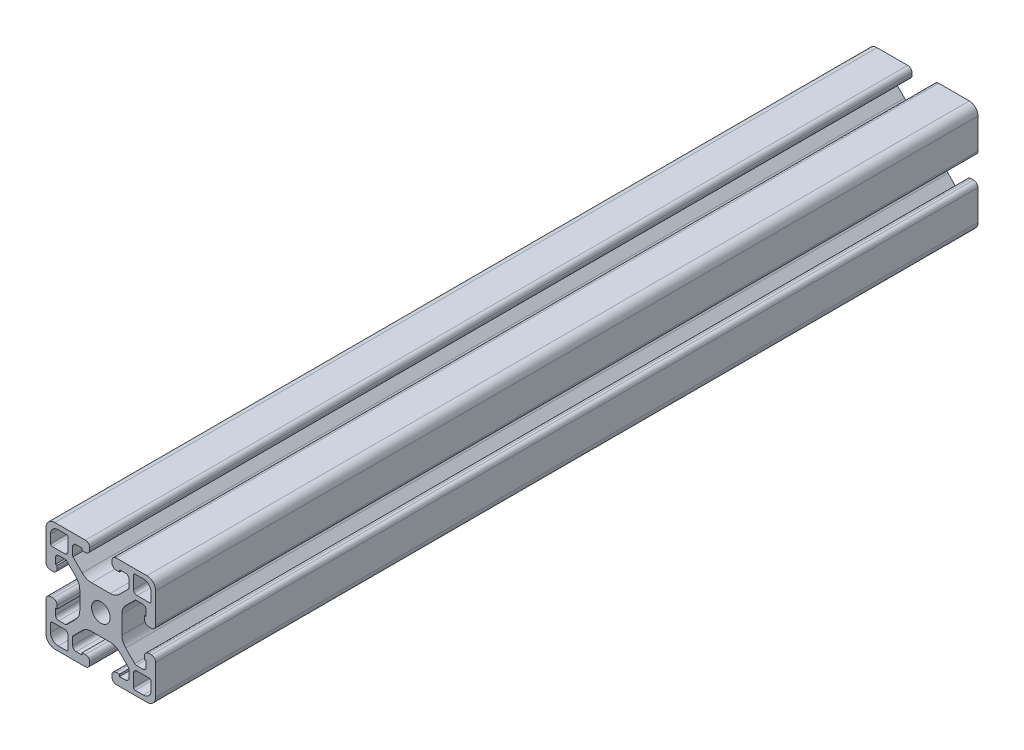
from build123d import *

# Parameters (mm, degrees)
SKETCH1_R      = 3.4
EXTRUDE1_DEPTH = 300


with BuildPart() as part:
    # Sketch1 → Extrude1 (new body)
    with BuildSketch(Plane.XY):
        with BuildLine():
            Line((7.685, 3.358241745), (7.685, -3.358241745))
            ThreePointArc((7.685, -3.358241745), (8.046005845, -5.174620093), (9.074149602, -6.714904463))
            Line((9.074149602, -6.714904463), (12.373454754, -10.018325737))
            ThreePointArc((12.373454754, -10.018325737), (12.662327453, -10.211539726), (13.003171987, -10.279393143))
            Line((13.003171987, -10.279393143), (15.298849809, -10.279393143))
            ThreePointArc((15.298849809, -10.279393143), (16.196875422, -9.907418755), (16.568849809, -9.009393143))
            Line((16.568849809, -9.009393143), (16.568849809, -6.901425905))
            Line((16.568849809, -6.901425905), (15.94, -6.901425905))
            Line((15.94, -6.901425905), (15.94, -5.758104362))
            ThreePointArc((15.94, -5.758104362), (16.399842354, -4.647946715), (17.51, -4.188104362))
            Line((17.51, -4.188104362), (18.43, -4.188104362))
            ThreePointArc((18.43, -4.188104362), (19.540157646, -4.647946715), (20, -5.758104362))
            Line((20, -5.758104362), (20, -13.186220555))
            Line((20, -13.186220555), (20, -16.83))
            ThreePointArc((20, -16.83), (19.071528496, -19.071528496), (16.83, -20))
            Line((16.83, -20), (13.004526429, -20))
            Line((13.004526429, -20), (5.63, -20))
            ThreePointArc((5.63, -20), (4.519842354, -19.540157646), (4.06, -18.43))
            Line((4.06, -18.43), (4.06, -17.696220555))
            ThreePointArc((4.06, -17.696220555), (4.519842354, -16.586062909), (5.63, -16.126220555))
            Line((5.63, -16.126220555), (6.7839284, -16.126220555))
            Line((6.7839284, -16.126220555), (6.7839284, -16.886683809))
            Line((6.7839284, -16.886683809), (9.015, -16.886683809))
            ThreePointArc((9.015, -16.886683809), (9.913025612, -16.514709421), (10.285, -15.616683809))
            Line((10.285, -15.616683809), (10.285, -12.922193682))
            ThreePointArc((10.285, -12.922193682), (10.254851172, -12.69250702), (10.166447275, -12.47838167))
            Line((10.166447275, -12.47838167), (6.770639403, -9.078337282))
            ThreePointArc((6.770639403, -9.078337282), (5.228903087, -8.047139023), (3.409789005, -7.685))
            Line((3.409789005, -7.685), (-3.409789005, -7.685))
            ThreePointArc((-3.409789005, -7.685), (-5.228903087, -8.047139023), (-6.770639403, -9.078337282))
            Line((-6.770639403, -9.078337282), (-10.166447275, -12.47838167))
            ThreePointArc((-10.166447275, -12.47838167), (-10.254851172, -12.69250702), (-10.285, -12.922193682))
            Line((-10.285, -12.922193682), (-10.285, -15.616683809))
            ThreePointArc((-10.285, -15.616683809), (-9.913025612, -16.514709421), (-9.015, -16.886683809))
            Line((-9.015, -16.886683809), (-6.7839284, -16.886683809))
            Line((-6.7839284, -16.886683809), (-6.7839284, -16.126220555))
            Line((-6.7839284, -16.126220555), (-5.63, -16.126220555))
            ThreePointArc((-5.63, -16.126220555), (-4.519842354, -16.586062909), (-4.06, -17.696220555))
            Line((-4.06, -17.696220555), (-4.06, -18.43))
            ThreePointArc((-4.06, -18.43), (-4.519842354, -19.540157646), (-5.63, -20))
            Line((-5.63, -20), (-13.004526429, -20))
            Line((-13.004526429, -20), (-16.83, -20))
            ThreePointArc((-16.83, -20), (-19.071528496, -19.071528496), (-20, -16.83))
            Line((-20, -16.83), (-20, -13.186220555))
            Line((-20, -13.186220555), (-20, -5.758104362))
            ThreePointArc((-20, -5.758104362), (-19.540157646, -4.647946715), (-18.43, -4.188104362))
            Line((-18.43, -4.188104362), (-17.51, -4.188104362))
            ThreePointArc((-17.51, -4.188104362), (-16.399842354, -4.647946715), (-15.94, -5.758104362))
            Line((-15.94, -5.758104362), (-15.94, -6.901425905))
            Line((-15.94, -6.901425905), (-16.568849809, -6.901425905))
            Line((-16.568849809, -6.901425905), (-16.568849809, -9.009393143))
            ThreePointArc((-16.568849809, -9.009393143), (-16.196875422, -9.907418755), (-15.298849809, -10.279393143))
            Line((-15.298849809, -10.279393143), (-13.003171987, -10.279393143))
            ThreePointArc((-13.003171987, -10.279393143), (-12.662327453, -10.211539726), (-12.373454754, -10.018325737))
            Line((-12.373454754, -10.018325737), (-9.074149602, -6.714904463))
            ThreePointArc((-9.074149602, -6.714904463), (-8.046005845, -5.174620093), (-7.685, -3.358241745))
            Line((-7.685, -3.358241745), (-7.685, 3.358241745))
            ThreePointArc((-7.685, 3.358241745), (-8.046005845, 5.174620093), (-9.074149602, 6.714904463))
            Line((-9.074149602, 6.714904463), (-12.373454754, 10.018325737))
            ThreePointArc((-12.373454754, 10.018325737), (-12.662327453, 10.211539726), (-13.003171987, 10.279393143))
            Line((-13.003171987, 10.279393143), (-15.298849809, 10.279393143))
            ThreePointArc((-15.298849809, 10.279393143), (-16.196875422, 9.907418755), (-16.568849809, 9.009393143))
            Line((-16.568849809, 9.009393143), (-16.568849809, 6.901425905))
            Line((-16.568849809, 6.901425905), (-15.94, 6.901425905))
            Line((-15.94, 6.901425905), (-15.94, 5.758104362))
            ThreePointArc((-15.94, 5.758104362), (-16.399842354, 4.647946715), (-17.51, 4.188104362))
            Line((-17.51, 4.188104362), (-18.43, 4.188104362))
            ThreePointArc((-18.43, 4.188104362), (-19.540157646, 4.647946715), (-20, 5.758104362))
            Line((-20, 5.758104362), (-20, 13.186220555))
            Line((-20, 13.186220555), (-20, 16.83))
            ThreePointArc((-20, 16.83), (-19.071528496, 19.071528496), (-16.83, 20))
            Line((-16.83, 20), (-13.004526429, 20))
            Line((-13.004526429, 20), (-5.63, 20))
            ThreePointArc((-5.63, 20), (-4.519842354, 19.540157646), (-4.06, 18.43))
            Line((-4.06, 18.43), (-4.06, 17.696220555))
            ThreePointArc((-4.06, 17.696220555), (-4.519842354, 16.586062909), (-5.63, 16.126220555))
            Line((-5.63, 16.126220555), (-6.7839284, 16.126220555))
            Line((-6.7839284, 16.126220555), (-6.7839284, 16.886683809))
            Line((-6.7839284, 16.886683809), (-9.015, 16.886683809))
            ThreePointArc((-9.015, 16.886683809), (-9.913025612, 16.514709421), (-10.285, 15.616683809))
            Line((-10.285, 15.616683809), (-10.285, 12.922193682))
            ThreePointArc((-10.285, 12.922193682), (-10.254851172, 12.69250702), (-10.166447275, 12.47838167))
            Line((-10.166447275, 12.47838167), (-6.770639403, 9.078337282))
            ThreePointArc((-6.770639403, 9.078337282), (-5.228903087, 8.047139023), (-3.409789005, 7.685))
            Line((-3.409789005, 7.685), (3.409789005, 7.685))
            ThreePointArc((3.409789005, 7.685), (5.228903087, 8.047139023), (6.770639403, 9.078337282))
            Line((6.770639403, 9.078337282), (10.166447275, 12.47838167))
            ThreePointArc((10.166447275, 12.47838167), (10.254851172, 12.69250702), (10.285, 12.922193682))
            Line((10.285, 12.922193682), (10.285, 15.616683809))
            ThreePointArc((10.285, 15.616683809), (9.913025612, 16.514709421), (9.015, 16.886683809))
            Line((9.015, 16.886683809), (6.7839284, 16.886683809))
            Line((6.7839284, 16.886683809), (6.7839284, 16.126220555))
            Line((6.7839284, 16.126220555), (5.63, 16.126220555))
            ThreePointArc((5.63, 16.126220555), (4.519842354, 16.586062909), (4.06, 17.696220555))
            Line((4.06, 17.696220555), (4.06, 18.43))
            ThreePointArc((4.06, 18.43), (4.519842354, 19.540157646), (5.63, 20))
            Line((5.63, 20), (13.004526429, 20))
            Line((13.004526429, 20), (16.83, 20))
            ThreePointArc((16.83, 20), (19.071528496, 19.071528496), (20, 16.83))
            Line((20, 16.83), (20, 13.186220555))
            Line((20, 13.186220555), (20, 5.758104362))
            ThreePointArc((20, 5.758104362), (19.540157646, 4.647946715), (18.43, 4.188104362))
            Line((18.43, 4.188104362), (17.51, 4.188104362))
            ThreePointArc((17.51, 4.188104362), (16.399842354, 4.647946715), (15.94, 5.758104362))
            Line((15.94, 5.758104362), (15.94, 6.901425905))
            Line((15.94, 6.901425905), (16.568849809, 6.901425905))
            Line((16.568849809, 6.901425905), (16.568849809, 9.009393143))
            ThreePointArc((16.568849809, 9.009393143), (16.196875422, 9.907418755), (15.298849809, 10.279393143))
            Line((15.298849809, 10.279393143), (13.003171987, 10.279393143))
            ThreePointArc((13.003171987, 10.279393143), (12.662327453, 10.211539726), (12.373454754, 10.018325737))
            Line((12.373454754, 10.018325737), (9.074149602, 6.714904463))
            ThreePointArc((9.074149602, 6.714904463), (8.046005845, 5.174620093), (7.685, 3.358241745))
        make_face()
        Circle(SKETCH1_R, mode=Mode.SUBTRACT)
        with BuildLine():
            Line((12.57, 18.35), (15.55, 18.35))
            ThreePointArc((15.55, 18.35), (17.529898987, 17.529898987), (18.35, 15.55))
            Line((18.35, 15.55), (18.35, 12.57))
            ThreePointArc((18.35, 12.57), (18.165477272, 12.124522728), (17.72, 11.94))
            Line((17.72, 11.94), (13.21, 11.94))
            ThreePointArc((13.21, 11.94), (12.311974388, 12.311974388), (11.94, 13.21))
            Line((11.94, 13.21), (11.94, 17.72))
            ThreePointArc((11.94, 17.72), (12.124522728, 18.165477272), (12.57, 18.35))
        make_face(mode=Mode.SUBTRACT)
        with BuildLine():
            Line((-12.57, -18.35), (-15.55, -18.35))
            ThreePointArc((-15.55, -18.35), (-17.529898987, -17.529898987), (-18.35, -15.55))
            Line((-18.35, -15.55), (-18.35, -12.57))
            ThreePointArc((-18.35, -12.57), (-18.165477272, -12.124522728), (-17.72, -11.94))
            Line((-17.72, -11.94), (-13.21, -11.94))
            ThreePointArc((-13.21, -11.94), (-12.311974388, -12.311974388), (-11.94, -13.21))
            Line((-11.94, -13.21), (-11.94, -17.72))
            ThreePointArc((-11.94, -17.72), (-12.124522728, -18.165477272), (-12.57, -18.35))
        make_face(mode=Mode.SUBTRACT)
        with BuildLine():
            Line((18.35, -15.55), (18.35, -12.57))
            ThreePointArc((18.35, -12.57), (18.165477272, -12.124522728), (17.72, -11.94))
            Line((17.72, -11.94), (13.21, -11.94))
            ThreePointArc((13.21, -11.94), (12.311974388, -12.311974388), (11.94, -13.21))
            Line((11.94, -13.21), (11.94, -17.72))
            ThreePointArc((11.94, -17.72), (12.124522728, -18.165477272), (12.57, -18.35))
            Line((12.57, -18.35), (15.55, -18.35))
            ThreePointArc((15.55, -18.35), (17.529898987, -17.529898987), (18.35, -15.55))
        make_face(mode=Mode.SUBTRACT)
        with BuildLine():
            Line((-18.35, 15.55), (-18.35, 12.57))
            ThreePointArc((-18.35, 12.57), (-18.165477272, 12.124522728), (-17.72, 11.94))
            Line((-17.72, 11.94), (-13.21, 11.94))
            ThreePointArc((-13.21, 11.94), (-12.311974388, 12.311974388), (-11.94, 13.21))
            Line((-11.94, 13.21), (-11.94, 17.72))
            ThreePointArc((-11.94, 17.72), (-12.124522728, 18.165477272), (-12.57, 18.35))
            Line((-12.57, 18.35), (-15.55, 18.35))
            ThreePointArc((-15.55, 18.35), (-17.529898987, 17.529898987), (-18.35, 15.55))
        make_face(mode=Mode.SUBTRACT)
    extrude(amount=-EXTRUDE1_DEPTH)


solid = part.part
